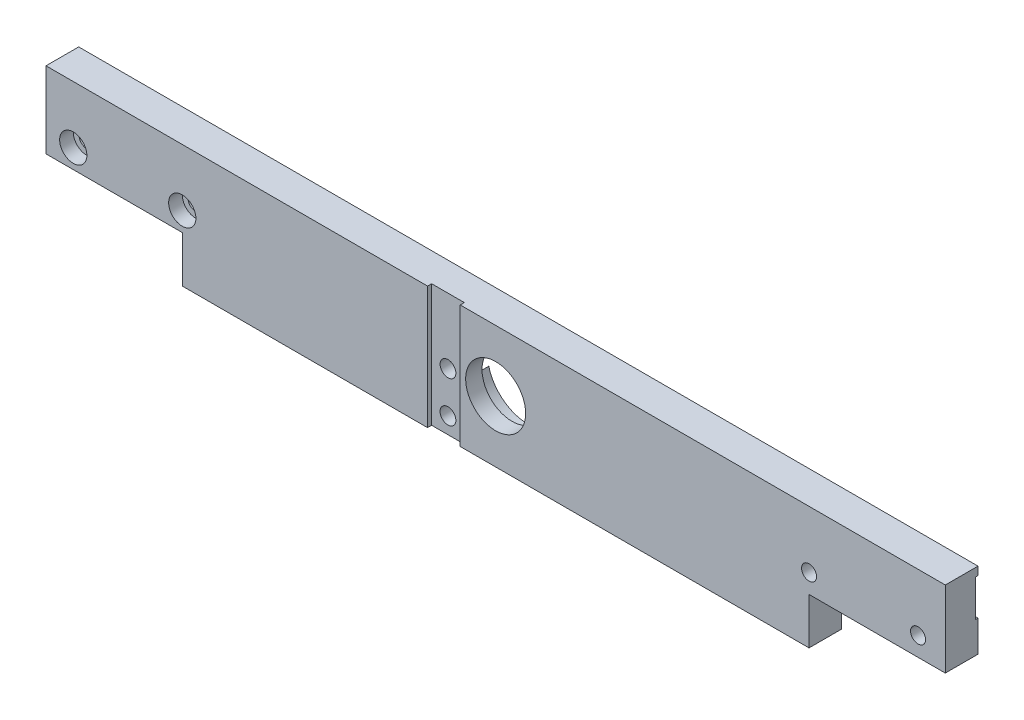
from build123d import *

# Parameters (mm, degrees)
SKETCH_1_W                   = 330
SKETCH_1_H                   = 45
EXTRUDE_1_DEPTH              = 12
HOLE_WIZARD_M5_1_D           = 5.8
HOLE_WIZARD_M5_1_CBORE_D     = 10
HOLE_WIZARD_M5_1_CBORE_DEPTH = 5
SKETCH_4_W                   = 1
SKETCH_4_H                   = 16.5
CUT_EXTRUDE_1_DEPTH          = 334.27016068
SKETCH_5_W                   = 330
SKETCH_5_H                   = 3
EXTRUDE_2_DEPTH              = 1
SKETCH_6_R                   = 11
CUT_EXTRUDE_2_DEPTH          = 334.27016068
SKETCH_9_W                   = 50
SKETCH_9_H                   = 17
CUT_EXTRUDE_5_DEPTH          = 334.27016068
SKETCH_10_W                  = 12
SKETCH_10_H                  = 1.5
CUT_EXTRUDE_6_DEPTH          = 334.27016068
SKETCH_11_R                  = 15
CUT_EXTRUDE_7_DEPTH          = 6
SKETCH_14_R                  = 2.75
CUT_EXTRUDE_8_DEPTH          = 334.27016068
HOLE_WIZARD_M5_2_D           = 5.8
HOLE_WIZARD_M5_2_CBORE_D     = 10
HOLE_WIZARD_M5_2_CBORE_DEPTH = 5


with BuildPart() as part:
    # 草图1 → 凸台-拉伸1 (new body)
    with BuildSketch(Plane.XY):
        with Locations((165, 22.5)):
            Rectangle(SKETCH_1_W, SKETCH_1_H)
    extrude(amount=EXTRUDE_1_DEPTH)

    # M5 六角凹头螺钉的柱形沉头孔1 (through all)
    with Locations(Plane.XY.offset(12)):
        with Locations((10, 24), (50, 24)):
            CounterBoreHole(HOLE_WIZARD_M5_1_D / 2, HOLE_WIZARD_M5_1_CBORE_D / 2, HOLE_WIZARD_M5_1_CBORE_DEPTH)

    # 草图4 → 切除-拉伸1 (cut, through all)
    with BuildSketch(Plane.ZY):
        with Locations((0.5, 36.75)):
            Rectangle(SKETCH_4_W, SKETCH_4_H)
    extrude(amount=-CUT_EXTRUDE_1_DEPTH, mode=Mode.SUBTRACT)

    # 草图5 → 凸台-拉伸2 (add)
    with BuildSketch(Plane(origin=(0, 0, 1), x_dir=(-1, 0, 0), z_dir=(0, 0, -1))):
        with Locations((-165, 43.5)):
            Rectangle(SKETCH_5_W, SKETCH_5_H)
    extrude(amount=EXTRUDE_2_DEPTH)

    # 草图6 → 切除-拉伸2 (cut, through all)
    with BuildSketch(Plane.XY.offset(12)):
        with Locations((165, 22.5)):
            Circle(SKETCH_6_R)
    extrude(amount=-CUT_EXTRUDE_2_DEPTH, mode=Mode.SUBTRACT)

    # 草图9 → 切除-拉伸5 (cut, through all)
    with BuildSketch(Plane.XY.offset(12)):
        with Locations((25, 8.5)):
            Rectangle(SKETCH_9_W, SKETCH_9_H)
        with Locations((305, 8.5)):
            Rectangle(SKETCH_9_W, SKETCH_9_H)
    extrude(amount=-CUT_EXTRUDE_5_DEPTH, mode=Mode.SUBTRACT)

    # 草图10 → 切除-拉伸6 (cut, through all)
    with BuildSketch(Plane.XZ):
        with Locations((146, 11.25)):
            Rectangle(SKETCH_10_W, SKETCH_10_H)
    extrude(amount=-CUT_EXTRUDE_6_DEPTH, mode=Mode.SUBTRACT)

    # 草图11 → 切除-拉伸7 (cut)
    with BuildSketch(Plane(origin=(0, 0, 0), x_dir=(-1, 0, 0), z_dir=(0, 0, -1))):
        with Locations((-165, 22.5)):
            Circle(SKETCH_11_R)
    extrude(amount=-CUT_EXTRUDE_7_DEPTH, mode=Mode.SUBTRACT)

    # 草图14 → 切除-拉伸8 (cut, through all)
    with BuildSketch(Plane.XY.offset(12)):
        with Locations((280, 24)):
            Circle(SKETCH_14_R)
        with Locations((320, 24)):
            Circle(SKETCH_14_R)
    extrude(amount=-CUT_EXTRUDE_8_DEPTH, mode=Mode.SUBTRACT)

    # M5 六角凹头螺钉的柱形沉头孔2 (through all)
    with Locations(Plane(origin=(0, 0, 0), x_dir=(-1, 0, 0), z_dir=(0, 0, -1))):
        with Locations((-146, 6), (-146, 21)):
            CounterBoreHole(HOLE_WIZARD_M5_2_D / 2, HOLE_WIZARD_M5_2_CBORE_D / 2, HOLE_WIZARD_M5_2_CBORE_DEPTH)


solid = part.part
